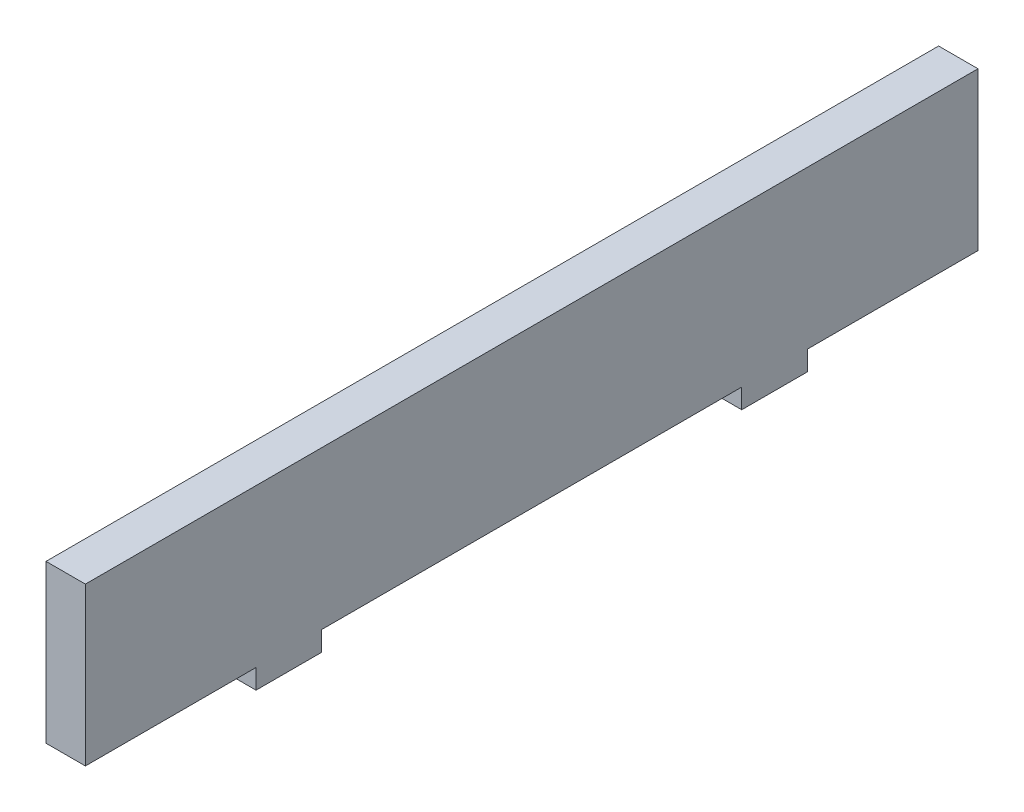
from build123d import *

# Parameters (mm, degrees)
ESBO_O1_W                = 3
ESBO_O1_H                = 68
RESSALTO_EXTRUS_O1_DEPTH = 12
ESBO_O2_W                = 5
ESBO_O2_H                = 1.5
RESSALTO_EXTRUS_O2_DEPTH = 3


with BuildPart() as part:
    # Esboço1 → Ressalto-extrusão1 (new body)
    with BuildSketch(Plane(origin=(0, 0, 0), x_dir=(1, 0, 0), z_dir=(0, 1, 0))):
        Rectangle(ESBO_O1_W, ESBO_O1_H)
    extrude(amount=RESSALTO_EXTRUS_O1_DEPTH)

    # Esboço2 → Ressalto-extrusão2 (add)
    with BuildSketch(Plane(origin=(1.5, 0, 0), x_dir=(0, 0, -1), z_dir=(1, 0, 0))):
        with Locations((-18.5, -0.75)):
            Rectangle(ESBO_O2_W, ESBO_O2_H)
        with Locations((18.5, -0.75)):
            Rectangle(ESBO_O2_W, ESBO_O2_H)
    extrude(amount=-RESSALTO_EXTRUS_O2_DEPTH)


solid = part.part
